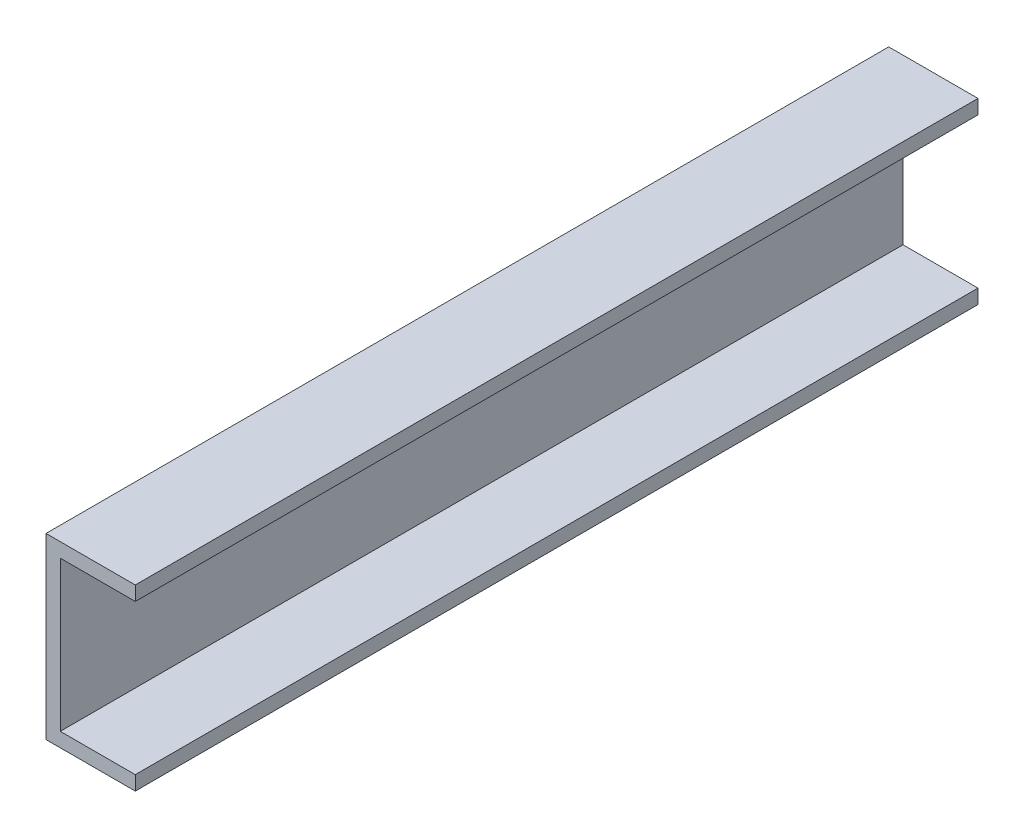
from build123d import *

# Parameters (mm, degrees)
BOSS_EXTRUDE1_DEPTH = 472


with BuildPart() as part:
    # Sketch1 → Boss-Extrude1 (new body)
    with BuildSketch(Plane.XY):
        Polygon((0, 0), (0, -100), (50, -100), (50, -92), (8, -92), (8, -8), (50, -8), (50, 0), align=None)
    extrude(amount=BOSS_EXTRUDE1_DEPTH)


solid = part.part
